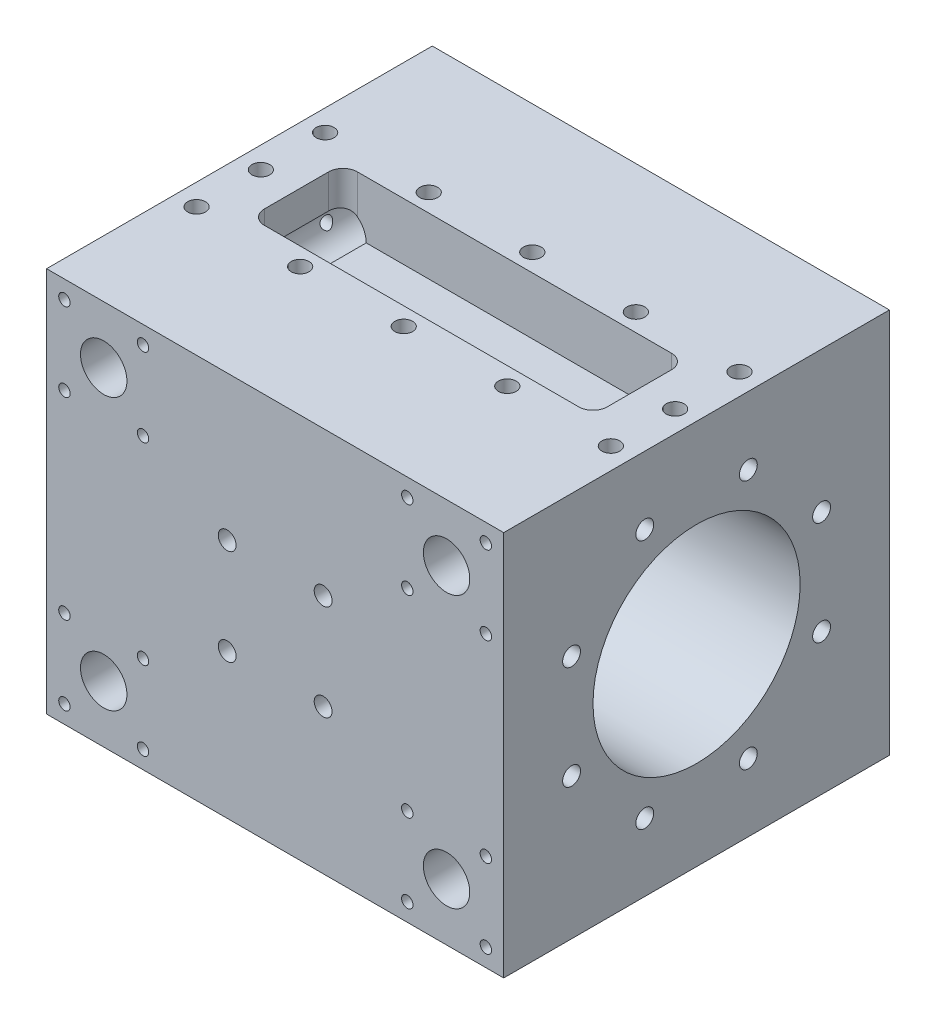
from build123d import *

# Parameters (mm, degrees)
SKETCH1_W                       = 64
SKETCH1_H                       = 54
BOSS_EXTRUDE1_DEPTH             = 27
CUT_EXTRUDE1_DEPTH              = 8
M3X0_5_TAPPED_HOLE1_AT_2_COUNT  = 2
M3X0_5_TAPPED_HOLE1_AT_2_PITCH  = 9
M3X0_5_TAPPED_HOLE1_AT_3_COUNT  = 2
M3X0_5_TAPPED_HOLE1_AT_3_PITCH  = 9
M3X0_5_TAPPED_HOLE1_AT_4_COUNT  = 2
M3X0_5_TAPPED_HOLE1_AT_4_PITCH  = 17.066048166
M3X0_5_TAPPED_HOLE1_AT_5_COUNT  = 2
M3X0_5_TAPPED_HOLE1_AT_5_PITCH  = 30.364452901
M3X0_5_TAPPED_HOLE1_AT_6_COUNT  = 2
M3X0_5_TAPPED_HOLE1_AT_6_PITCH  = 44.421278685
M3X0_5_TAPPED_HOLE1_AT_7_COUNT  = 2
M3X0_5_TAPPED_HOLE1_AT_7_PITCH  = 58.694122363
M3X0_5_TAPPED_HOLE1_AT_8_COUNT  = 2
M3X0_5_TAPPED_HOLE1_AT_8_PITCH  = 58
M3X0_5_TAPPED_HOLE1_AT_9_COUNT  = 2
M3X0_5_TAPPED_HOLE1_AT_9_PITCH  = 58.694122363
M3X0_5_TAPPED_HOLE1_AT_10_COUNT = 2
M3X0_5_TAPPED_HOLE1_AT_10_PITCH = 44.421278685
M3X0_5_TAPPED_HOLE1_AT_11_COUNT = 2
M3X0_5_TAPPED_HOLE1_AT_11_PITCH = 30.364452901
M3X0_5_TAPPED_HOLE1_AT_12_COUNT = 2
M3X0_5_TAPPED_HOLE1_AT_12_PITCH = 17.066048166
SKETCH8_2_R                     = 14.5
CUT_EXTRUDE2_DEPTH              = 75.525163536
CIRPATTERN1_COUNT               = 8
M3X0_5_TAPPED_HOLE3_AT_2_COUNT  = 2
M3X0_5_TAPPED_HOLE3_AT_2_PITCH  = 13.435028843
M3X0_5_TAPPED_HOLE3_AT_3_COUNT  = 2
M3X0_5_TAPPED_HOLE3_AT_3_PITCH  = 19
M3X0_5_TAPPED_HOLE3_AT_4_COUNT  = 2
M3X0_5_TAPPED_HOLE3_AT_4_PITCH  = 13.435028843
SKETCH15_2_R                    = 3.25
CUT_EXTRUDE3_DEPTH              = 69.330081223
LPATTERN1_COUNT                 = 2
LPATTERN1_PITCH                 = 11
LPATTERN1_COUNT_DIR2            = 2
LPATTERN1_PITCH_DIR2            = 11
LPATTERN2_COUNT                 = 2
LPATTERN2_PITCH                 = 48
LPATTERN2_COUNT_DIR2            = 2
LPATTERN2_PITCH_DIR2            = 38
MIRROR3_COPY_7_SKETCH_R         = 3.25
MIRROR3_COPY_7_DEPTH            = 69.330081223
MIRROR3_COPY_8_SKETCH_R         = 3.25
MIRROR3_COPY_8_DEPTH            = 69.330081223
MIRROR3_COPY_9_SKETCH_R         = 3.25
MIRROR3_COPY_9_DEPTH            = 69.330081223
MIRROR3_COPY_22_SKETCH_R        = 3.25
MIRROR3_COPY_22_DEPTH           = 69.330081223


with BuildPart() as part:
    # Sketch1 → Boss-Extrude1 (new, symmetric)
    with BuildSketch(Plane(origin=(0, 0, 0), x_dir=(1, 0, 0), z_dir=(0, 1, 0))):
        Rectangle(SKETCH1_W, SKETCH1_H)
    extrude(amount=BOSS_EXTRUDE1_DEPTH, both=True)

    # Sketch2 → Cut-Extrude1 (cut)
    with BuildSketch(Plane(origin=(0, 27, 0), x_dir=(1, 0, 0), z_dir=(0, 1, 0))):
        with BuildLine():
            Line((-22, -6.5), (22, -6.5))
            ThreePointArc((22, -6.5), (23.414213562, -5.914213562), (24, -4.5))
            Line((24, -4.5), (24, 4.5))
            ThreePointArc((24, 4.5), (23.414213562, 5.914213562), (22, 6.5))
            Line((22, 6.5), (-22, 6.5))
            ThreePointArc((-22, 6.5), (-23.414213562, 5.914213562), (-24, 4.5))
            Line((-24, 4.5), (-24, -4.5))
            ThreePointArc((-24, -4.5), (-23.414213562, -5.914213562), (-22, -6.5))
        make_face()
    cut_extrude1 = extrude(amount=-CUT_EXTRUDE1_DEPTH, mode=Mode.SUBTRACT)

    # Sketch6 → M3x0.5 Tapped Hole1 (revolve, cut)
    with BuildSketch(Plane(origin=(-29, 27, 0), x_dir=(0, 0, 1), z_dir=(1, 0, 0))):
        Polygon((0, 0), (0, 5.5), (1.25, 4.748924226), (1.25, 0), align=None)
    m3x0_5_tapped_hole1 = revolve(axis=Axis((-29, 33.35, 0), (0, -1, 0)), mode=Mode.SUBTRACT)

    # M3x0.5 Tapped Hole1 at 2: M3x0.5 Tapped Hole1 ×2
    with Locations(*[(0, 0, -i * M3X0_5_TAPPED_HOLE1_AT_2_PITCH) for i in range(1, M3X0_5_TAPPED_HOLE1_AT_2_COUNT)]):
        add(m3x0_5_tapped_hole1, mode=Mode.SUBTRACT)

    # M3x0.5 Tapped Hole1 at 3: M3x0.5 Tapped Hole1 ×2
    with Locations(*[(0, 0, i * M3X0_5_TAPPED_HOLE1_AT_3_PITCH) for i in range(1, M3X0_5_TAPPED_HOLE1_AT_3_COUNT)]):
        add(m3x0_5_tapped_hole1, mode=Mode.SUBTRACT)

    # M3x0.5 Tapped Hole1 at 4: M3x0.5 Tapped Hole1 ×2
    with Locations(*[Vector(0.8496401661981191, 0, 0.5273628617781427) * (i * M3X0_5_TAPPED_HOLE1_AT_4_PITCH) for i in range(1, M3X0_5_TAPPED_HOLE1_AT_4_COUNT)]):
        add(m3x0_5_tapped_hole1, mode=Mode.SUBTRACT)

    # M3x0.5 Tapped Hole1 at 5: M3x0.5 Tapped Hole1 ×2
    with Locations(*[Vector(0.9550641368112371, 0, 0.2963992148724529) * (i * M3X0_5_TAPPED_HOLE1_AT_5_PITCH) for i in range(1, M3X0_5_TAPPED_HOLE1_AT_5_COUNT)]):
        add(m3x0_5_tapped_hole1, mode=Mode.SUBTRACT)

    # M3x0.5 Tapped Hole1 at 6: M3x0.5 Tapped Hole1 ×2
    with Locations(*[Vector(0.9792604195071027, 0, 0.2026056040359523) * (i * M3X0_5_TAPPED_HOLE1_AT_6_PITCH) for i in range(1, M3X0_5_TAPPED_HOLE1_AT_6_COUNT)]):
        add(m3x0_5_tapped_hole1, mode=Mode.SUBTRACT)

    # M3x0.5 Tapped Hole1 at 7: M3x0.5 Tapped Hole1 ×2
    with Locations(*[Vector(0.9881739033591791, 0, 0.15333732983159676) * (i * M3X0_5_TAPPED_HOLE1_AT_7_PITCH) for i in range(1, M3X0_5_TAPPED_HOLE1_AT_7_COUNT)]):
        add(m3x0_5_tapped_hole1, mode=Mode.SUBTRACT)

    # M3x0.5 Tapped Hole1 at 8: M3x0.5 Tapped Hole1 ×2
    with Locations(*[(i * M3X0_5_TAPPED_HOLE1_AT_8_PITCH, 0, 0) for i in range(1, M3X0_5_TAPPED_HOLE1_AT_8_COUNT)]):
        add(m3x0_5_tapped_hole1, mode=Mode.SUBTRACT)

    # M3x0.5 Tapped Hole1 at 9: M3x0.5 Tapped Hole1 ×2
    with Locations(*[Vector(0.9881739033591791, 0, -0.15333732983159679) * (i * M3X0_5_TAPPED_HOLE1_AT_9_PITCH) for i in range(1, M3X0_5_TAPPED_HOLE1_AT_9_COUNT)]):
        add(m3x0_5_tapped_hole1, mode=Mode.SUBTRACT)

    # M3x0.5 Tapped Hole1 at 10: M3x0.5 Tapped Hole1 ×2
    with Locations(*[Vector(0.9792604195071027, 0, -0.2026056040359523) * (i * M3X0_5_TAPPED_HOLE1_AT_10_PITCH) for i in range(1, M3X0_5_TAPPED_HOLE1_AT_10_COUNT)]):
        add(m3x0_5_tapped_hole1, mode=Mode.SUBTRACT)

    # M3x0.5 Tapped Hole1 at 11: M3x0.5 Tapped Hole1 ×2
    with Locations(*[Vector(0.9550641368112371, 0, -0.2963992148724529) * (i * M3X0_5_TAPPED_HOLE1_AT_11_PITCH) for i in range(1, M3X0_5_TAPPED_HOLE1_AT_11_COUNT)]):
        add(m3x0_5_tapped_hole1, mode=Mode.SUBTRACT)

    # M3x0.5 Tapped Hole1 at 12: M3x0.5 Tapped Hole1 ×2
    with Locations(*[Vector(0.8496401661981191, 0, -0.5273628617781428) * (i * M3X0_5_TAPPED_HOLE1_AT_12_PITCH) for i in range(1, M3X0_5_TAPPED_HOLE1_AT_12_COUNT)]):
        add(m3x0_5_tapped_hole1, mode=Mode.SUBTRACT)

    # Mirror1: Cut-Extrude1, M3x0.5 Tapped Hole1 across plane
    add(cut_extrude1.mirror(Plane.ZX), mode=Mode.SUBTRACT)
    add(m3x0_5_tapped_hole1.mirror(Plane.ZX), mode=Mode.SUBTRACT)

    # Mirror1 copy 1 sketch → Mirror1 copy 1 (revolve, cut)
    with BuildSketch(Plane(origin=(-29, -27, -9), x_dir=(0, 0, 1), z_dir=(1, 0, 0))):
        Polygon((0, 0), (0, -5.5), (1.25, -4.748924226), (1.25, 0), align=None)
    revolve(axis=Axis((-29, -33.35, -9), (0, -1, 0)), mode=Mode.SUBTRACT)

    # Mirror1 copy 2 sketch → Mirror1 copy 2 (revolve, cut)
    with BuildSketch(Plane(origin=(-29, -27, 9), x_dir=(0, 0, 1), z_dir=(1, 0, 0))):
        Polygon((0, 0), (0, -5.5), (1.25, -4.748924226), (1.25, 0), align=None)
    revolve(axis=Axis((-29, -33.35, 9), (0, -1, 0)), mode=Mode.SUBTRACT)

    # Mirror1 copy 3 sketch → Mirror1 copy 3 (revolve, cut)
    with BuildSketch(Plane(origin=(-14.5, -27, 9), x_dir=(0, 0, 1), z_dir=(1, 0, 0))):
        Polygon((0, 0), (0, -5.5), (1.25, -4.748924226), (1.25, 0), align=None)
    revolve(axis=Axis((-14.5, -33.35, 9), (0, -1, 0)), mode=Mode.SUBTRACT)

    # Mirror1 copy 4 sketch → Mirror1 copy 4 (revolve, cut)
    with BuildSketch(Plane(origin=(0, -27, 9), x_dir=(0, 0, 1), z_dir=(1, 0, 0))):
        Polygon((0, 0), (0, -5.5), (1.25, -4.748924226), (1.25, 0), align=None)
    revolve(axis=Axis((0, -33.35, 9), (0, -1, 0)), mode=Mode.SUBTRACT)

    # Mirror1 copy 5 sketch → Mirror1 copy 5 (revolve, cut)
    with BuildSketch(Plane(origin=(14.5, -27, 9), x_dir=(0, 0, 1), z_dir=(1, 0, 0))):
        Polygon((0, 0), (0, -5.5), (1.25, -4.748924226), (1.25, 0), align=None)
    revolve(axis=Axis((14.5, -33.35, 9), (0, -1, 0)), mode=Mode.SUBTRACT)

    # Mirror1 copy 6 sketch → Mirror1 copy 6 (revolve, cut)
    with BuildSketch(Plane(origin=(29, -27, 9), x_dir=(0, 0, 1), z_dir=(1, 0, 0))):
        Polygon((0, 0), (0, -5.5), (1.25, -4.748924226), (1.25, 0), align=None)
    revolve(axis=Axis((29, -33.35, 9), (0, -1, 0)), mode=Mode.SUBTRACT)

    # Mirror1 copy 7 sketch → Mirror1 copy 7 (revolve, cut)
    with BuildSketch(Plane(origin=(29, -27, 0), x_dir=(0, 0, 1), z_dir=(1, 0, 0))):
        Polygon((0, 0), (0, -5.5), (1.25, -4.748924226), (1.25, 0), align=None)
    revolve(axis=Axis((29, -33.35, 0), (0, -1, 0)), mode=Mode.SUBTRACT)

    # Mirror1 copy 8 sketch → Mirror1 copy 8 (revolve, cut)
    with BuildSketch(Plane(origin=(29, -27, -9), x_dir=(0, 0, 1), z_dir=(1, 0, 0))):
        Polygon((0, 0), (0, -5.5), (1.25, -4.748924226), (1.25, 0), align=None)
    revolve(axis=Axis((29, -33.35, -9), (0, -1, 0)), mode=Mode.SUBTRACT)

    # Mirror1 copy 9 sketch → Mirror1 copy 9 (revolve, cut)
    with BuildSketch(Plane(origin=(14.5, -27, -9), x_dir=(0, 0, 1), z_dir=(1, 0, 0))):
        Polygon((0, 0), (0, -5.5), (1.25, -4.748924226), (1.25, 0), align=None)
    revolve(axis=Axis((14.5, -33.35, -9), (0, -1, 0)), mode=Mode.SUBTRACT)

    # Mirror1 copy 10 sketch → Mirror1 copy 10 (revolve, cut)
    with BuildSketch(Plane(origin=(0, -27, -9), x_dir=(0, 0, 1), z_dir=(1, 0, 0))):
        Polygon((0, 0), (0, -5.5), (1.25, -4.748924226), (1.25, 0), align=None)
    revolve(axis=Axis((0, -33.35, -9), (0, -1, 0)), mode=Mode.SUBTRACT)

    # Mirror1 copy 11 sketch → Mirror1 copy 11 (revolve, cut)
    with BuildSketch(Plane(origin=(-14.5, -27, -9), x_dir=(0, 0, 1), z_dir=(1, 0, 0))):
        Polygon((0, 0), (0, -5.5), (1.25, -4.748924226), (1.25, 0), align=None)
    revolve(axis=Axis((-14.5, -33.35, -9), (0, -1, 0)), mode=Mode.SUBTRACT)

    # Sketch9 → M3x0.5 Tapped Hole2 (revolve, cut)
    with BuildSketch(Plane(origin=(32, 7.248737342, -17.5), x_dir=(0, 0, -1), z_dir=(0, 1, 0))):
        Polygon((0, 0), (0, 5.5), (1.25, 4.748924226), (1.25, 0), align=None)
    m3x0_5_tapped_hole2 = revolve(axis=Axis((38.35, 7.248737342, -17.5), (-1, 0, 0)), mode=Mode.SUBTRACT)

    # Sketch8<2> → Cut-Extrude2 (cut, through all)
    with BuildSketch(Plane(origin=(32, 0, 0), x_dir=(0, 0, -1), z_dir=(1, 0, 0))):
        Circle(SKETCH8_2_R)
    extrude(amount=-CUT_EXTRUDE2_DEPTH, mode=Mode.SUBTRACT)

    # CirPattern1: M3x0.5 Tapped Hole2 ×8 about axis
    cirpattern1_axis = Axis((32, 0, 0), (1, 0, 0))
    for i in range(1, CIRPATTERN1_COUNT):
        add(m3x0_5_tapped_hole2.rotate(cirpattern1_axis, i * 360 / CIRPATTERN1_COUNT), mode=Mode.SUBTRACT)

    # Mirror2 copy 1 sketch → Mirror2 copy 1 (revolve, cut)
    with BuildSketch(Plane(origin=(-32, 17.5, -7.248737342), x_dir=(0, 0.7071067811865475, -0.7071067811865476), z_dir=(0, 0.7071067811865476, 0.7071067811865475))):
        Polygon((0, 0), (0, -5.5), (1.25, -4.748924226), (1.25, 0), align=None)
    revolve(axis=Axis((-38.35, 17.5, -7.248737342), (-1, 0, 0)), mode=Mode.SUBTRACT)

    # Mirror2 copy 2 sketch → Mirror2 copy 2 (revolve, cut)
    with BuildSketch(Plane(origin=(-32, 17.5, 7.248737342), x_dir=(0, 1, 0), z_dir=(0, 0, 1))):
        Polygon((0, 0), (0, -5.5), (1.25, -4.748924226), (1.25, 0), align=None)
    revolve(axis=Axis((-38.35, 17.5, 7.248737342), (-1, 0, 0)), mode=Mode.SUBTRACT)

    # Mirror2 copy 3 sketch → Mirror2 copy 3 (revolve, cut)
    with BuildSketch(Plane(origin=(-32, 7.248737342, 17.5), x_dir=(0, 0.7071067811865476, 0.7071067811865475), z_dir=(0, -0.7071067811865475, 0.7071067811865476))):
        Polygon((0, 0), (0, -5.5), (1.25, -4.748924226), (1.25, 0), align=None)
    revolve(axis=Axis((-38.35, 7.248737342, 17.5), (-1, 0, 0)), mode=Mode.SUBTRACT)

    # Mirror2 copy 4 sketch → Mirror2 copy 4 (revolve, cut)
    with BuildSketch(Plane(origin=(-32, -7.248737342, 17.5), x_dir=(0, 0, 1), z_dir=(0, -1, 0))):
        Polygon((0, 0), (0, -5.5), (1.25, -4.748924226), (1.25, 0), align=None)
    revolve(axis=Axis((-38.35, -7.248737342, 17.5), (-1, 0, 0)), mode=Mode.SUBTRACT)

    # Mirror2 copy 5 sketch → Mirror2 copy 5 (revolve, cut)
    with BuildSketch(Plane(origin=(-32, -17.5, 7.248737342), x_dir=(0, -0.7071067811865475, 0.7071067811865477), z_dir=(0, -0.7071067811865477, -0.7071067811865475))):
        Polygon((0, 0), (0, -5.5), (1.25, -4.748924226), (1.25, 0), align=None)
    revolve(axis=Axis((-38.35, -17.5, 7.248737342), (-1, 0, 0)), mode=Mode.SUBTRACT)

    # Mirror2 copy 6 sketch → Mirror2 copy 6 (revolve, cut)
    with BuildSketch(Plane(origin=(-32, -17.5, -7.248737342), x_dir=(0, -1, 0), z_dir=(0, 0, -1))):
        Polygon((0, 0), (0, -5.5), (1.25, -4.748924226), (1.25, 0), align=None)
    revolve(axis=Axis((-38.35, -17.5, -7.248737342), (-1, 0, 0)), mode=Mode.SUBTRACT)

    # Mirror2 copy 7 sketch → Mirror2 copy 7 (revolve, cut)
    with BuildSketch(Plane(origin=(-32, -7.248737342, -17.5), x_dir=(0, -0.7071067811865477, -0.7071067811865474), z_dir=(0, 0.7071067811865474, -0.7071067811865477))):
        Polygon((0, 0), (0, -5.5), (1.25, -4.748924226), (1.25, 0), align=None)
    revolve(axis=Axis((-38.35, -7.248737342, -17.5), (-1, 0, 0)), mode=Mode.SUBTRACT)

    # Mirror2 copy 8 sketch → Mirror2 copy 8 (revolve, cut)
    with BuildSketch(Plane(origin=(-32, 7.248737342, -17.5), x_dir=(0, 0, -1), z_dir=(0, 1, 0))):
        Polygon((0, 0), (0, -5.5), (1.25, -4.748924226), (1.25, 0), align=None)
    revolve(axis=Axis((-38.35, 7.248737342, -17.5), (-1, 0, 0)), mode=Mode.SUBTRACT)

    # Sketch13 → M3x0.5 Tapped Hole3 (revolve, cut)
    with BuildSketch(Plane(origin=(6.717514421, 6.717514421, -27), x_dir=(0, 1, 0), z_dir=(1, 0, 0))):
        Polygon((0, 0), (0, 6.5), (1.25, 5.748924226), (1.25, 0), align=None)
    m3x0_5_tapped_hole3 = revolve(axis=Axis((6.717514421, 6.717514421, -33.35), (0, 0, 1)), mode=Mode.SUBTRACT)

    # M3x0.5 Tapped Hole3 at 2: M3x0.5 Tapped Hole3 ×2
    with Locations(*[(-i * M3X0_5_TAPPED_HOLE3_AT_2_PITCH, 0, 0) for i in range(1, M3X0_5_TAPPED_HOLE3_AT_2_COUNT)]):
        add(m3x0_5_tapped_hole3, mode=Mode.SUBTRACT)

    # M3x0.5 Tapped Hole3 at 3: M3x0.5 Tapped Hole3 ×2
    with Locations(*[Vector(-0.7071067811865476, -0.7071067811865476, 0) * (i * M3X0_5_TAPPED_HOLE3_AT_3_PITCH) for i in range(1, M3X0_5_TAPPED_HOLE3_AT_3_COUNT)]):
        add(m3x0_5_tapped_hole3, mode=Mode.SUBTRACT)

    # M3x0.5 Tapped Hole3 at 4: M3x0.5 Tapped Hole3 ×2
    with Locations(*[(0, -i * M3X0_5_TAPPED_HOLE3_AT_4_PITCH, 0) for i in range(1, M3X0_5_TAPPED_HOLE3_AT_4_COUNT)]):
        add(m3x0_5_tapped_hole3, mode=Mode.SUBTRACT)

    # Sketch16 → M2x0.4 Tapped Hole1 (revolve, cut)
    with BuildSketch(Plane(origin=(18.5, 24.5, -27), x_dir=(0, 1, 0), z_dir=(1, 0, 0))):
        Polygon((0, 0), (0, 6.2), (0.8, 5.719311505), (0.8, 0), align=None)
    m2x0_4_tapped_hole1 = revolve(axis=Axis((18.5, 24.5, -33.35), (0, 0, 1)), mode=Mode.SUBTRACT)

    # Sketch15<2> → Cut-Extrude3 (cut, through all)
    with BuildSketch(Plane(origin=(0, 0, -27), x_dir=(-1, 0, 0), z_dir=(0, 0, -1))):
        with Locations((-24, 19)):
            Circle(SKETCH15_2_R)
    cut_extrude3 = extrude(amount=-CUT_EXTRUDE3_DEPTH, mode=Mode.SUBTRACT)

    # LPattern1: M2x0.4 Tapped Hole1 2 × 2
    with Locations(*[(i * LPATTERN1_PITCH, -j * LPATTERN1_PITCH_DIR2, 0) for i in range(LPATTERN1_COUNT) for j in range(LPATTERN1_COUNT_DIR2) if (i, j) != (0, 0)]):
        add(m2x0_4_tapped_hole1, mode=Mode.SUBTRACT)

    # LPattern2: Cut-Extrude3 2 × 2
    with Locations(*[(-i * LPATTERN2_PITCH, -j * LPATTERN2_PITCH_DIR2, 0) for i in range(LPATTERN2_COUNT) for j in range(LPATTERN2_COUNT_DIR2) if (i, j) != (0, 0)]):
        add(cut_extrude3, mode=Mode.SUBTRACT)

    # LPattern2 copy 1 sketch → LPattern2 copy 1 (revolve, cut)
    with BuildSketch(Plane(origin=(18.5, -24.5, -27), x_dir=(0, 1, 0), z_dir=(1, 0, 0))):
        Polygon((0, 0), (0, 6.2), (0.8, 5.719311505), (0.8, 0), align=None)
    revolve(axis=Axis((18.5, -24.5, -33.35), (0, 0, 1)), mode=Mode.SUBTRACT)

    # LPattern2 copy 2 sketch → LPattern2 copy 2 (revolve, cut)
    with BuildSketch(Plane(origin=(-29.5, 13.5, -27), x_dir=(0, 1, 0), z_dir=(1, 0, 0))):
        Polygon((0, 0), (0, 6.2), (0.8, 5.719311505), (0.8, 0), align=None)
    revolve(axis=Axis((-29.5, 13.5, -33.35), (0, 0, 1)), mode=Mode.SUBTRACT)

    # LPattern2 copy 3 sketch → LPattern2 copy 3 (revolve, cut)
    with BuildSketch(Plane(origin=(-29.5, -24.5, -27), x_dir=(0, 1, 0), z_dir=(1, 0, 0))):
        Polygon((0, 0), (0, 6.2), (0.8, 5.719311505), (0.8, 0), align=None)
    revolve(axis=Axis((-29.5, -24.5, -33.35), (0, 0, 1)), mode=Mode.SUBTRACT)

    # LPattern2 copy 4 sketch → LPattern2 copy 4 (revolve, cut)
    with BuildSketch(Plane(origin=(29.5, -13.5, -27), x_dir=(0, 1, 0), z_dir=(1, 0, 0))):
        Polygon((0, 0), (0, 6.2), (0.8, 5.719311505), (0.8, 0), align=None)
    revolve(axis=Axis((29.5, -13.5, -33.35), (0, 0, 1)), mode=Mode.SUBTRACT)

    # LPattern2 copy 5 sketch → LPattern2 copy 5 (revolve, cut)
    with BuildSketch(Plane(origin=(-18.5, 24.5, -27), x_dir=(0, 1, 0), z_dir=(1, 0, 0))):
        Polygon((0, 0), (0, 6.2), (0.8, 5.719311505), (0.8, 0), align=None)
    revolve(axis=Axis((-18.5, 24.5, -33.35), (0, 0, 1)), mode=Mode.SUBTRACT)

    # LPattern2 copy 6 sketch → LPattern2 copy 6 (revolve, cut)
    with BuildSketch(Plane(origin=(-18.5, -13.5, -27), x_dir=(0, 1, 0), z_dir=(1, 0, 0))):
        Polygon((0, 0), (0, 6.2), (0.8, 5.719311505), (0.8, 0), align=None)
    revolve(axis=Axis((-18.5, -13.5, -33.35), (0, 0, 1)), mode=Mode.SUBTRACT)

    # LPattern2 copy 7 sketch → LPattern2 copy 7 (revolve, cut)
    with BuildSketch(Plane(origin=(29.5, -24.5, -27), x_dir=(0, 1, 0), z_dir=(1, 0, 0))):
        Polygon((0, 0), (0, 6.2), (0.8, 5.719311505), (0.8, 0), align=None)
    revolve(axis=Axis((29.5, -24.5, -33.35), (0, 0, 1)), mode=Mode.SUBTRACT)

    # LPattern2 copy 8 sketch → LPattern2 copy 8 (revolve, cut)
    with BuildSketch(Plane(origin=(-18.5, 13.5, -27), x_dir=(0, 1, 0), z_dir=(1, 0, 0))):
        Polygon((0, 0), (0, 6.2), (0.8, 5.719311505), (0.8, 0), align=None)
    revolve(axis=Axis((-18.5, 13.5, -33.35), (0, 0, 1)), mode=Mode.SUBTRACT)

    # LPattern2 copy 9 sketch → LPattern2 copy 9 (revolve, cut)
    with BuildSketch(Plane(origin=(-18.5, -24.5, -27), x_dir=(0, 1, 0), z_dir=(1, 0, 0))):
        Polygon((0, 0), (0, 6.2), (0.8, 5.719311505), (0.8, 0), align=None)
    revolve(axis=Axis((-18.5, -24.5, -33.35), (0, 0, 1)), mode=Mode.SUBTRACT)

    # LPattern2 copy 10 sketch → LPattern2 copy 10 (revolve, cut)
    with BuildSketch(Plane(origin=(18.5, -13.5, -27), x_dir=(0, 1, 0), z_dir=(1, 0, 0))):
        Polygon((0, 0), (0, 6.2), (0.8, 5.719311505), (0.8, 0), align=None)
    revolve(axis=Axis((18.5, -13.5, -33.35), (0, 0, 1)), mode=Mode.SUBTRACT)

    # LPattern2 copy 11 sketch → LPattern2 copy 11 (revolve, cut)
    with BuildSketch(Plane(origin=(-29.5, 24.5, -27), x_dir=(0, 1, 0), z_dir=(1, 0, 0))):
        Polygon((0, 0), (0, 6.2), (0.8, 5.719311505), (0.8, 0), align=None)
    revolve(axis=Axis((-29.5, 24.5, -33.35), (0, 0, 1)), mode=Mode.SUBTRACT)

    # LPattern2 copy 12 sketch → LPattern2 copy 12 (revolve, cut)
    with BuildSketch(Plane(origin=(-29.5, -13.5, -27), x_dir=(0, 1, 0), z_dir=(1, 0, 0))):
        Polygon((0, 0), (0, 6.2), (0.8, 5.719311505), (0.8, 0), align=None)
    revolve(axis=Axis((-29.5, -13.5, -33.35), (0, 0, 1)), mode=Mode.SUBTRACT)

    # Mirror3: M3x0.5 Tapped Hole3, M2x0.4 Tapped Hole1 across plane
    add(m3x0_5_tapped_hole3.mirror(Plane.XY), mode=Mode.SUBTRACT)
    add(m2x0_4_tapped_hole1.mirror(Plane.XY), mode=Mode.SUBTRACT)

    # Mirror3 copy 1 sketch → Mirror3 copy 1 (revolve, cut)
    with BuildSketch(Plane(origin=(-6.717514421, 6.717514421, 27), x_dir=(0, 1, 0), z_dir=(1, 0, 0))):
        Polygon((0, 0), (0, -6.5), (1.25, -5.748924226), (1.25, 0), align=None)
    revolve(axis=Axis((-6.717514421, 6.717514421, 33.35), (0, 0, 1)), mode=Mode.SUBTRACT)

    # Mirror3 copy 2 sketch → Mirror3 copy 2 (revolve, cut)
    with BuildSketch(Plane(origin=(-6.717514421, -6.717514421, 27), x_dir=(0, 1, 0), z_dir=(1, 0, 0))):
        Polygon((0, 0), (0, -6.5), (1.25, -5.748924226), (1.25, 0), align=None)
    revolve(axis=Axis((-6.717514421, -6.717514421, 33.35), (0, 0, 1)), mode=Mode.SUBTRACT)

    # Mirror3 copy 3 sketch → Mirror3 copy 3 (revolve, cut)
    with BuildSketch(Plane(origin=(6.717514421, -6.717514421, 27), x_dir=(0, 1, 0), z_dir=(1, 0, 0))):
        Polygon((0, 0), (0, -6.5), (1.25, -5.748924226), (1.25, 0), align=None)
    revolve(axis=Axis((6.717514421, -6.717514421, 33.35), (0, 0, 1)), mode=Mode.SUBTRACT)

    # Mirror3 copy 4 sketch → Mirror3 copy 4 (revolve, cut)
    with BuildSketch(Plane(origin=(18.5, 13.5, 27), x_dir=(0, 1, 0), z_dir=(1, 0, 0))):
        Polygon((0, 0), (0, -6.2), (0.8, -5.719311505), (0.8, 0), align=None)
    revolve(axis=Axis((18.5, 13.5, 33.35), (0, 0, 1)), mode=Mode.SUBTRACT)

    # Mirror3 copy 5 sketch → Mirror3 copy 5 (revolve, cut)
    with BuildSketch(Plane(origin=(29.5, 24.5, 27), x_dir=(0, 1, 0), z_dir=(1, 0, 0))):
        Polygon((0, 0), (0, -6.2), (0.8, -5.719311505), (0.8, 0), align=None)
    revolve(axis=Axis((29.5, 24.5, 33.35), (0, 0, 1)), mode=Mode.SUBTRACT)

    # Mirror3 copy 6 sketch → Mirror3 copy 6 (revolve, cut)
    with BuildSketch(Plane(origin=(29.5, 13.5, 27), x_dir=(0, 1, 0), z_dir=(1, 0, 0))):
        Polygon((0, 0), (0, -6.2), (0.8, -5.719311505), (0.8, 0), align=None)
    revolve(axis=Axis((29.5, 13.5, 33.35), (0, 0, 1)), mode=Mode.SUBTRACT)

    # Mirror3 copy 7 sketch → Mirror3 copy 7 (cut, through all)
    with BuildSketch(Plane(origin=(0, -38, 27), x_dir=(-1, 0, 0), z_dir=(0, 0, 1))):
        with Locations((-24, -19)):
            Circle(MIRROR3_COPY_7_SKETCH_R)
    extrude(amount=-MIRROR3_COPY_7_DEPTH, mode=Mode.SUBTRACT)

    # Mirror3 copy 8 sketch → Mirror3 copy 8 (cut, through all)
    with BuildSketch(Plane(origin=(-48, 0, 27), x_dir=(-1, 0, 0), z_dir=(0, 0, 1))):
        with Locations((-24, -19)):
            Circle(MIRROR3_COPY_8_SKETCH_R)
    extrude(amount=-MIRROR3_COPY_8_DEPTH, mode=Mode.SUBTRACT)

    # Mirror3 copy 9 sketch → Mirror3 copy 9 (cut, through all)
    with BuildSketch(Plane(origin=(-48, -38, 27), x_dir=(-1, 0, 0), z_dir=(0, 0, 1))):
        with Locations((-24, -19)):
            Circle(MIRROR3_COPY_9_SKETCH_R)
    extrude(amount=-MIRROR3_COPY_9_DEPTH, mode=Mode.SUBTRACT)

    # Mirror3 copy 10 sketch → Mirror3 copy 10 (revolve, cut)
    with BuildSketch(Plane(origin=(18.5, -24.5, 27), x_dir=(0, 1, 0), z_dir=(1, 0, 0))):
        Polygon((0, 0), (0, -6.2), (0.8, -5.719311505), (0.8, 0), align=None)
    revolve(axis=Axis((18.5, -24.5, 33.35), (0, 0, 1)), mode=Mode.SUBTRACT)

    # Mirror3 copy 11 sketch → Mirror3 copy 11 (revolve, cut)
    with BuildSketch(Plane(origin=(-29.5, 13.5, 27), x_dir=(0, 1, 0), z_dir=(1, 0, 0))):
        Polygon((0, 0), (0, -6.2), (0.8, -5.719311505), (0.8, 0), align=None)
    revolve(axis=Axis((-29.5, 13.5, 33.35), (0, 0, 1)), mode=Mode.SUBTRACT)

    # Mirror3 copy 12 sketch → Mirror3 copy 12 (revolve, cut)
    with BuildSketch(Plane(origin=(-29.5, -24.5, 27), x_dir=(0, 1, 0), z_dir=(1, 0, 0))):
        Polygon((0, 0), (0, -6.2), (0.8, -5.719311505), (0.8, 0), align=None)
    revolve(axis=Axis((-29.5, -24.5, 33.35), (0, 0, 1)), mode=Mode.SUBTRACT)

    # Mirror3 copy 13 sketch → Mirror3 copy 13 (revolve, cut)
    with BuildSketch(Plane(origin=(29.5, -13.5, 27), x_dir=(0, 1, 0), z_dir=(1, 0, 0))):
        Polygon((0, 0), (0, -6.2), (0.8, -5.719311505), (0.8, 0), align=None)
    revolve(axis=Axis((29.5, -13.5, 33.35), (0, 0, 1)), mode=Mode.SUBTRACT)

    # Mirror3 copy 14 sketch → Mirror3 copy 14 (revolve, cut)
    with BuildSketch(Plane(origin=(-18.5, 24.5, 27), x_dir=(0, 1, 0), z_dir=(1, 0, 0))):
        Polygon((0, 0), (0, -6.2), (0.8, -5.719311505), (0.8, 0), align=None)
    revolve(axis=Axis((-18.5, 24.5, 33.35), (0, 0, 1)), mode=Mode.SUBTRACT)

    # Mirror3 copy 15 sketch → Mirror3 copy 15 (revolve, cut)
    with BuildSketch(Plane(origin=(-18.5, -13.5, 27), x_dir=(0, 1, 0), z_dir=(1, 0, 0))):
        Polygon((0, 0), (0, -6.2), (0.8, -5.719311505), (0.8, 0), align=None)
    revolve(axis=Axis((-18.5, -13.5, 33.35), (0, 0, 1)), mode=Mode.SUBTRACT)

    # Mirror3 copy 16 sketch → Mirror3 copy 16 (revolve, cut)
    with BuildSketch(Plane(origin=(29.5, -24.5, 27), x_dir=(0, 1, 0), z_dir=(1, 0, 0))):
        Polygon((0, 0), (0, -6.2), (0.8, -5.719311505), (0.8, 0), align=None)
    revolve(axis=Axis((29.5, -24.5, 33.35), (0, 0, 1)), mode=Mode.SUBTRACT)

    # Mirror3 copy 17 sketch → Mirror3 copy 17 (revolve, cut)
    with BuildSketch(Plane(origin=(-18.5, 13.5, 27), x_dir=(0, 1, 0), z_dir=(1, 0, 0))):
        Polygon((0, 0), (0, -6.2), (0.8, -5.719311505), (0.8, 0), align=None)
    revolve(axis=Axis((-18.5, 13.5, 33.35), (0, 0, 1)), mode=Mode.SUBTRACT)

    # Mirror3 copy 18 sketch → Mirror3 copy 18 (revolve, cut)
    with BuildSketch(Plane(origin=(-18.5, -24.5, 27), x_dir=(0, 1, 0), z_dir=(1, 0, 0))):
        Polygon((0, 0), (0, -6.2), (0.8, -5.719311505), (0.8, 0), align=None)
    revolve(axis=Axis((-18.5, -24.5, 33.35), (0, 0, 1)), mode=Mode.SUBTRACT)

    # Mirror3 copy 19 sketch → Mirror3 copy 19 (revolve, cut)
    with BuildSketch(Plane(origin=(18.5, -13.5, 27), x_dir=(0, 1, 0), z_dir=(1, 0, 0))):
        Polygon((0, 0), (0, -6.2), (0.8, -5.719311505), (0.8, 0), align=None)
    revolve(axis=Axis((18.5, -13.5, 33.35), (0, 0, 1)), mode=Mode.SUBTRACT)

    # Mirror3 copy 20 sketch → Mirror3 copy 20 (revolve, cut)
    with BuildSketch(Plane(origin=(-29.5, 24.5, 27), x_dir=(0, 1, 0), z_dir=(1, 0, 0))):
        Polygon((0, 0), (0, -6.2), (0.8, -5.719311505), (0.8, 0), align=None)
    revolve(axis=Axis((-29.5, 24.5, 33.35), (0, 0, 1)), mode=Mode.SUBTRACT)

    # Mirror3 copy 21 sketch → Mirror3 copy 21 (revolve, cut)
    with BuildSketch(Plane(origin=(-29.5, -13.5, 27), x_dir=(0, 1, 0), z_dir=(1, 0, 0))):
        Polygon((0, 0), (0, -6.2), (0.8, -5.719311505), (0.8, 0), align=None)
    revolve(axis=Axis((-29.5, -13.5, 33.35), (0, 0, 1)), mode=Mode.SUBTRACT)

    # Mirror3 copy 22 sketch → Mirror3 copy 22 (cut, through all)
    with BuildSketch(Plane(origin=(0, 0, 27), x_dir=(-1, 0, 0), z_dir=(0, 0, 1))):
        with Locations((-24, -19)):
            Circle(MIRROR3_COPY_22_SKETCH_R)
    extrude(amount=-MIRROR3_COPY_22_DEPTH, mode=Mode.SUBTRACT)


solid = part.part
